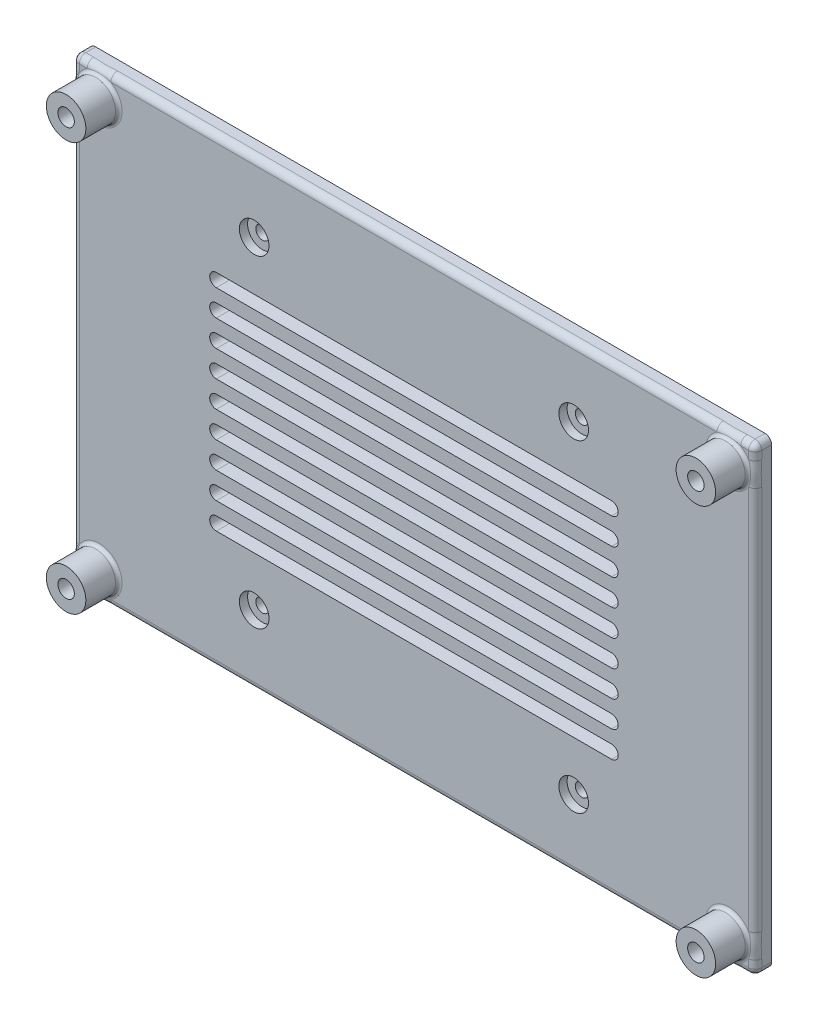
from build123d import *

# Parameters (mm, degrees)
ESQUISSE1_W                                   = 103.6
ESQUISSE1_H                                   = 70
ESQUISSE1_R                                   = 1.005
BOSS_EXTRU_1_DEPTH                            = 2.5
ESQUISSE3_R                                   = 3
BOSS_EXTRU_2_DEPTH                            = 5
CONG_2_R                                      = 0.5
TROU_POUR_TARAUDAGE_POUR_TROU_TARAUD_M3_D     = 2.5
TROU_POUR_TARAUDAGE_POUR_TROU_TARAUD_M3_DEPTH = 5
TROU_POUR_TARAUDAGE_POUR_TROU_TARAUD_M3_TIP   = 0.751075774
ESQUISSE19_R                                  = 2.25
ENL_V_MAT_EXTRU_1_DEPTH                       = 1.25
CONG_3_R                                      = 1
ENL_V_MAT_EXTRU_3_DEPTH                       = 63.71554845
R_P_TITION_LIN_AIRE2_COUNT                    = 5
R_P_TITION_LIN_AIRE2_PITCH                    = 4
R_P_TITION_LIN_AIRE2_COL_COUNT                = 5
R_P_TITION_LIN_AIRE2_COL_PITCH                = 4


with BuildPart() as part:
    # Esquisse1 → Boss.-Extru.1 (new body)
    with BuildSketch(Plane.XY):
        Rectangle(ESQUISSE1_W, ESQUISSE1_H)
        with Locations((-24.25, -24.5)):
            Circle(ESQUISSE1_R, mode=Mode.SUBTRACT)
        with Locations((-24.25, 24.5)):
            Circle(ESQUISSE1_R, mode=Mode.SUBTRACT)
        with Locations((24.25, -24.5)):
            Circle(ESQUISSE1_R, mode=Mode.SUBTRACT)
        with Locations((24.25, 24.5)):
            Circle(ESQUISSE1_R, mode=Mode.SUBTRACT)
    extrude(amount=BOSS_EXTRU_1_DEPTH)

    # Esquisse3 → Boss.-Extru.2 (add)
    with BuildSketch(Plane.XY.offset(2.5)):
        with Locations((-47.8, 31)):
            Circle(ESQUISSE3_R)
        with Locations((47.8, 31)):
            Circle(ESQUISSE3_R)
        with Locations((-47.8, -31)):
            Circle(ESQUISSE3_R)
        with Locations((47.8, -31)):
            Circle(ESQUISSE3_R)
    extrude(amount=BOSS_EXTRU_2_DEPTH)

    # Congé2
    cong_2_edges = [part.edges().sort_by_distance(p)[0] for p in [
        (44.8, 31, 2.5),
        (44.8, -31, 2.5),
        (-50.8, -31, 2.5),
        (-50.8, 31, 2.5),
    ]]
    fillet(cong_2_edges, radius=CONG_2_R)

    # Trou pour taraudage pour trou taraudé M32
    with Locations(Plane.XY.offset(7.5)):
        with Locations((-47.8, -31), (47.8, -31), (47.8, 31), (-47.8, 31)):
            Hole(TROU_POUR_TARAUDAGE_POUR_TROU_TARAUD_M3_D / 2, depth=TROU_POUR_TARAUDAGE_POUR_TROU_TARAUD_M3_DEPTH)
            with Locations((0, 0, -(TROU_POUR_TARAUDAGE_POUR_TROU_TARAUD_M3_DEPTH + TROU_POUR_TARAUDAGE_POUR_TROU_TARAUD_M3_TIP / 2))):  # 118° drill point
                Cone(0, TROU_POUR_TARAUDAGE_POUR_TROU_TARAUD_M3_D / 2, TROU_POUR_TARAUDAGE_POUR_TROU_TARAUD_M3_TIP, mode=Mode.SUBTRACT)

    # Esquisse19 → Enlèv. mat.-Extru.1 (cut)
    with BuildSketch(Plane.XY.offset(2.5)):
        with Locations((24.25, -24.5)):
            Circle(ESQUISSE19_R)
        with Locations((-24.25, -24.5)):
            Circle(ESQUISSE19_R)
        with Locations((-24.25, 24.5)):
            Circle(ESQUISSE19_R)
        with Locations((24.25, 24.5)):
            Circle(ESQUISSE19_R)
    extrude(amount=-ENL_V_MAT_EXTRU_1_DEPTH, mode=Mode.SUBTRACT)

    # Congé3
    cong_3_edges = [part.edges().sort_by_distance(p)[0] for p in [
        (-51.8, 0, 2.5),
        (0, -35, 2.5),
        (51.8, 0, 2.5),
        (51.8, -35, 1.25),
        (-51.8, -35, 1.25),
        (-51.8, 35, 1.25),
        (51.8, 35, 1.25),
        (0, 35, 2.5),
    ]]
    fillet(cong_3_edges, radius=CONG_3_R)

    # Esquisse22 → Enlèv. mat.-Extru.3 (cut, through all)
    with BuildSketch(Plane.XY.offset(2.5)):
        with BuildLine():
            Line((30, -1), (-30, -1))
            ThreePointArc((-30, -1), (-31, 0), (-30, 1))
            Line((-30, 1), (30, 1))
            ThreePointArc((30, 1), (31, 0), (30, -1))
        make_face()
    enl_v_mat_extru_3 = extrude(amount=-ENL_V_MAT_EXTRU_3_DEPTH, mode=Mode.SUBTRACT)

    # Répétition linéaire2: Enlèv. mat.-Extru.3 ×5
    with Locations(*[(0, i * R_P_TITION_LIN_AIRE2_PITCH, 0) for i in range(1, R_P_TITION_LIN_AIRE2_COUNT)]):
        add(enl_v_mat_extru_3, mode=Mode.SUBTRACT)

    # Répétition linéaire2 col: Enlèv. mat.-Extru.3 ×5
    with Locations(*[(0, -i * R_P_TITION_LIN_AIRE2_COL_PITCH, 0) for i in range(1, R_P_TITION_LIN_AIRE2_COL_COUNT)]):
        add(enl_v_mat_extru_3, mode=Mode.SUBTRACT)


solid = part.part
